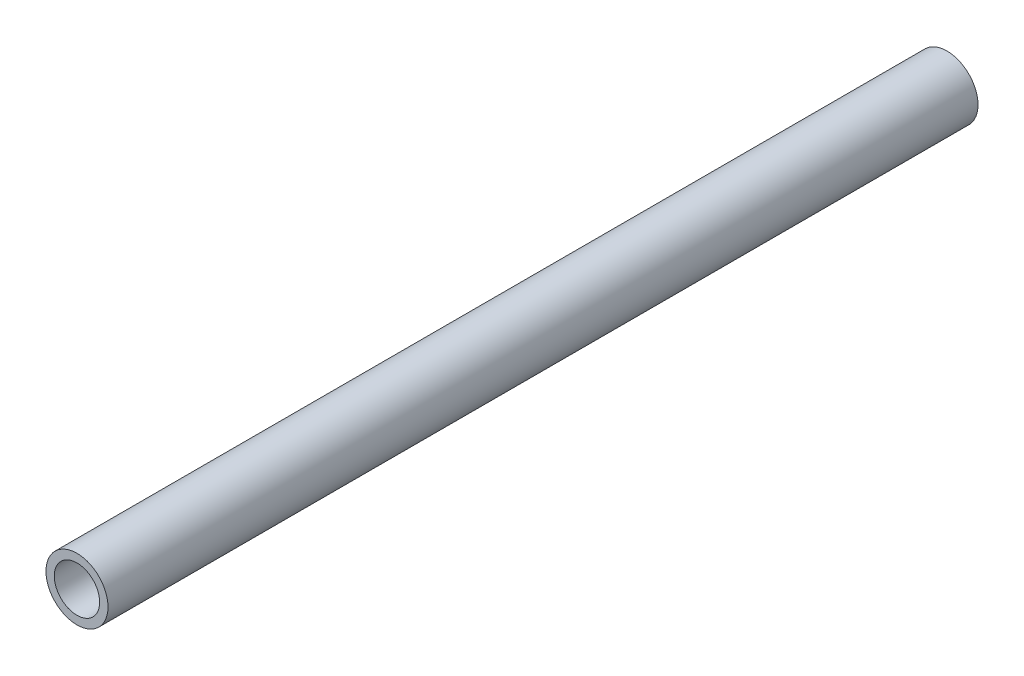
from build123d import *

# Parameters (mm, degrees)
CROQUIS1_R              = 10.7
CROQUIS1_R_2            = 7.825
SALIENTE_EXTRUIR1_DEPTH = 150


with BuildPart() as part:
    # Croquis1 → Saliente-Extruir1 (new, symmetric)
    with BuildSketch(Plane.XY):
        Circle(CROQUIS1_R)
        Circle(CROQUIS1_R_2, mode=Mode.SUBTRACT)
    extrude(amount=SALIENTE_EXTRUIR1_DEPTH, both=True)


solid = part.part
